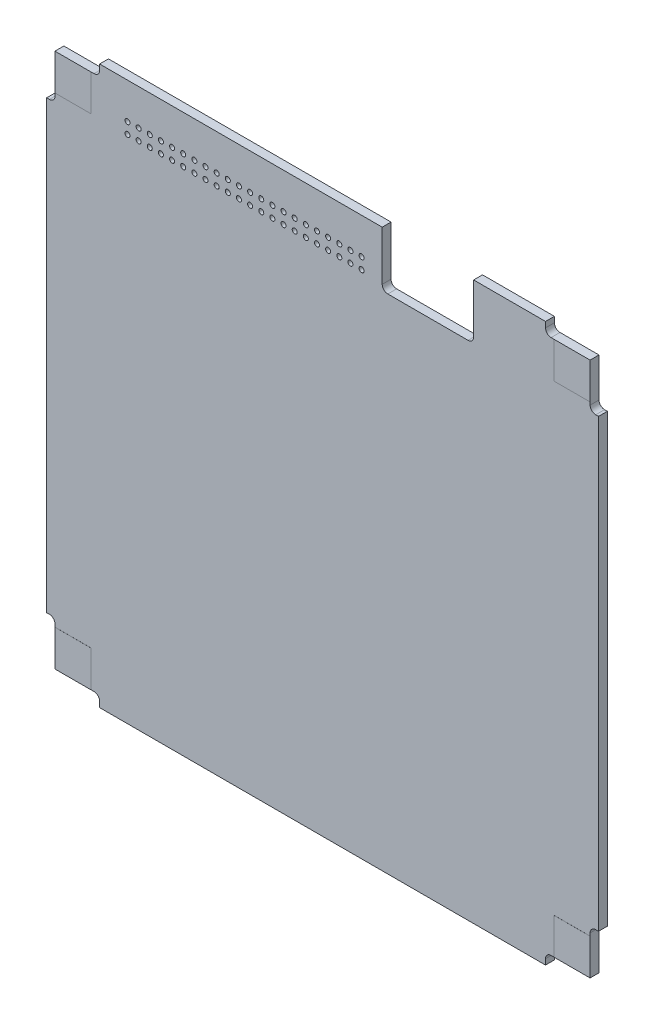
from build123d import *

# Parameters (mm, degrees)
BOSS_EXTRUDE1_DEPTH = 1.5875
FILLET1_R           = 1
SKETCH2_R           = 0.45
CUT_EXTRUDE1_DEPTH  = 71.728496069
CUT_EXTRUDE2_DEPTH  = 9.8806
FILLET2_R           = 1
SKETCH4_W           = 6.5
SKETCH4_H           = 6.5
BOSS_EXTRUDE2_DEPTH = 0.01
SKETCH5_OUTSIDE_W   = 130.286
SKETCH5_OUTSIDE_H   = 130.286
SKETCH5_OUTSIDE_W_2 = 99
SKETCH5_OUTSIDE_H_2 = 100
CUT_EXTRUDE3_DEPTH  = 71.728721226


with BuildPart() as part:
    # Sketch1 → Boss-Extrude1 (new body)
    with BuildSketch(Plane.XY):
        Polygon((40, 50), (-40, 50), (-40, 48), (-48, 48), (-48, 40), (-50, 40), (-50, -37.864895224), (-50, -40), (-48, -40), (-48, -48), (-40, -48), (-40, -50), (-37.864895224, -50), (40, -50), (40, -48), (48, -48), (48, -40), (50, -40), (50, 40), (48, 40), (48, 48), (40, 48), align=None)
    extrude(amount=BOSS_EXTRUDE1_DEPTH)

    # Fillet1
    fillet1_edges = [part.edges().sort_by_distance(p)[0] for p in [
        (-48, -40, 0.79375),
        (-48, 40, 0.79375),
        (-40, 48, 0.79375),
        (40, 48, 0.79375),
        (48, 40, 0.79375),
        (48, -40, 0.79375),
        (40, -48, 0.79375),
        (-40, -48, 0.79375),
    ]]
    fillet(fillet1_edges, radius=FILLET1_R)

    # Sketch2 → Cut-Extrude1 (cut, through all)
    with BuildSketch(Plane.XY.offset(1.5875)):
        with Locations((-35, 43.55)):
            Circle(SKETCH2_R)
        with Locations((-33, 43.55)):
            Circle(SKETCH2_R)
        with Locations((-31, 43.55)):
            Circle(SKETCH2_R)
        with Locations((-29, 43.55)):
            Circle(SKETCH2_R)
        with Locations((-27, 43.55)):
            Circle(SKETCH2_R)
        with Locations((-25, 43.55)):
            Circle(SKETCH2_R)
        with Locations((-23, 43.55)):
            Circle(SKETCH2_R)
        with Locations((-21, 43.55)):
            Circle(SKETCH2_R)
        with Locations((-19, 43.55)):
            Circle(SKETCH2_R)
        with Locations((-17, 43.55)):
            Circle(SKETCH2_R)
        with Locations((-15, 43.55)):
            Circle(SKETCH2_R)
        with Locations((-13, 43.55)):
            Circle(SKETCH2_R)
        with Locations((-11, 43.55)):
            Circle(SKETCH2_R)
        with Locations((-9, 43.55)):
            Circle(SKETCH2_R)
        with Locations((-7, 43.55)):
            Circle(SKETCH2_R)
        with Locations((-5, 43.55)):
            Circle(SKETCH2_R)
        with Locations((-3, 43.55)):
            Circle(SKETCH2_R)
        with Locations((-1, 43.55)):
            Circle(SKETCH2_R)
        with Locations((1, 43.55)):
            Circle(SKETCH2_R)
        with Locations((3, 43.55)):
            Circle(SKETCH2_R)
        with Locations((5, 43.55)):
            Circle(SKETCH2_R)
        with Locations((7, 43.55)):
            Circle(SKETCH2_R)
        with Locations((-33, 41.55)):
            Circle(SKETCH2_R)
        with Locations((-31, 41.55)):
            Circle(SKETCH2_R)
        with Locations((-29, 41.55)):
            Circle(SKETCH2_R)
        with Locations((-27, 41.55)):
            Circle(SKETCH2_R)
        with Locations((-25, 41.55)):
            Circle(SKETCH2_R)
        with Locations((-23, 41.55)):
            Circle(SKETCH2_R)
        with Locations((-21, 41.55)):
            Circle(SKETCH2_R)
        with Locations((-19, 41.55)):
            Circle(SKETCH2_R)
        with Locations((-17, 41.55)):
            Circle(SKETCH2_R)
        with Locations((-15, 41.55)):
            Circle(SKETCH2_R)
        with Locations((-13, 41.55)):
            Circle(SKETCH2_R)
        with Locations((-11, 41.55)):
            Circle(SKETCH2_R)
        with Locations((-9, 41.55)):
            Circle(SKETCH2_R)
        with Locations((-7, 41.55)):
            Circle(SKETCH2_R)
        with Locations((-5, 41.55)):
            Circle(SKETCH2_R)
        with Locations((-3, 41.55)):
            Circle(SKETCH2_R)
        with Locations((-1, 41.55)):
            Circle(SKETCH2_R)
        with Locations((1, 41.55)):
            Circle(SKETCH2_R)
        with Locations((3, 41.55)):
            Circle(SKETCH2_R)
        with Locations((5, 41.55)):
            Circle(SKETCH2_R)
        with Locations((7, 41.55)):
            Circle(SKETCH2_R)
        with Locations((-35, 41.55)):
            Circle(SKETCH2_R)
    extrude(amount=-CUT_EXTRUDE1_DEPTH, mode=Mode.SUBTRACT)

    # Sketch3 → Cut-Extrude2 (cut)
    with BuildSketch(Plane(origin=(0, 50, 0), x_dir=(1, 0, 0), z_dir=(0, 1, 0))):
        Polygon((10.7, 0), (19.7, 0), (27.1, 0), (27.1, -1.5875), (19.7, -1.5875), (10.7, -1.5875), align=None)
    extrude(amount=-CUT_EXTRUDE2_DEPTH, mode=Mode.SUBTRACT)

    # Fillet2
    fillet2_edges = [part.edges().sort_by_distance(p)[0] for p in [
        (10.7, 40.1194, 0.79375),
        (27.1, 40.1194, 0.79375),
    ]]
    fillet(fillet2_edges, radius=FILLET2_R)

    # Sketch4 → Boss-Extrude2 (add)
    with BuildSketch(Plane.XY.offset(1.5875)):
        with Locations((-44.75, 44.75)):
            Rectangle(SKETCH4_W, SKETCH4_H)
        with Locations((-44.75, -44.75)):
            Rectangle(SKETCH4_W, SKETCH4_H)
        with Locations((44.75, -44.75)):
            Rectangle(SKETCH4_W, SKETCH4_H)
        with Locations((44.75, 44.75)):
            Rectangle(SKETCH4_W, SKETCH4_H)
    extrude(amount=BOSS_EXTRUDE2_DEPTH)

    # Sketch5 outside → Cut-Extrude3 (cut, through all)
    with BuildSketch(Plane(origin=(0, 0, 0), x_dir=(-1, 0, 0), z_dir=(0, 0, -1))):
        Rectangle(SKETCH5_OUTSIDE_W, SKETCH5_OUTSIDE_H)
        Rectangle(SKETCH5_OUTSIDE_W_2, SKETCH5_OUTSIDE_H_2, mode=Mode.SUBTRACT)
    extrude(amount=-CUT_EXTRUDE3_DEPTH, mode=Mode.SUBTRACT)


solid = part.part
